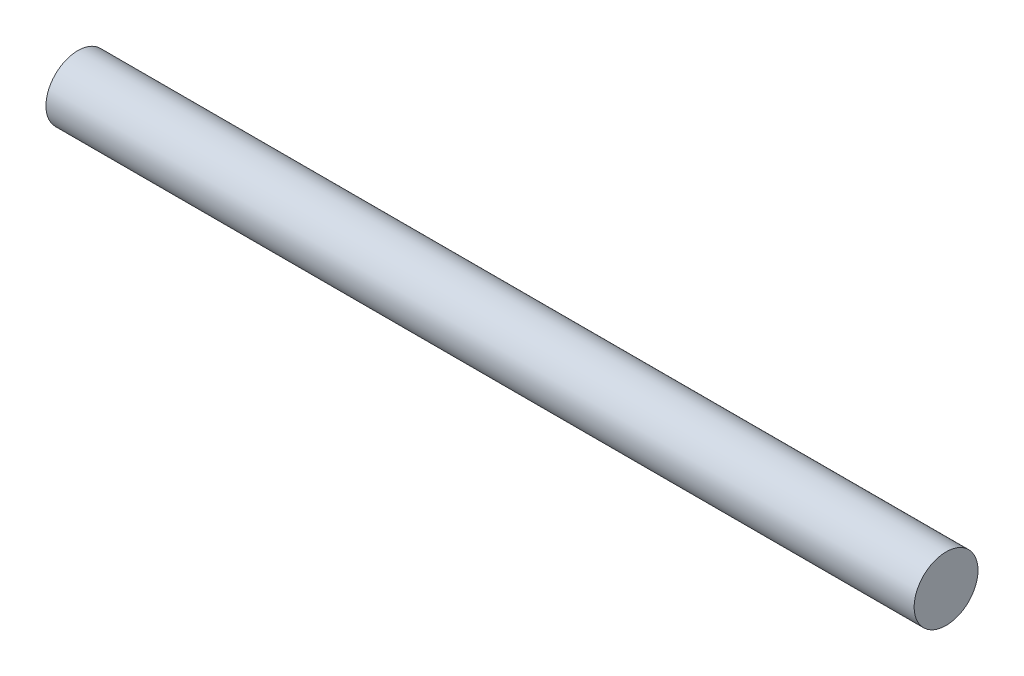
from build123d import *

# Parameters (mm, degrees)
SKETCH1_R           = 1.25
BOSS_EXTRUDE1_DEPTH = 34


with BuildPart() as part:
    # Sketch1 → Boss-Extrude1 (new body)
    with BuildSketch(Plane(origin=(0, 0, 0), x_dir=(0, 0, -1), z_dir=(1, 0, 0))):
        Circle(SKETCH1_R)
    extrude(amount=BOSS_EXTRUDE1_DEPTH)


solid = part.part
